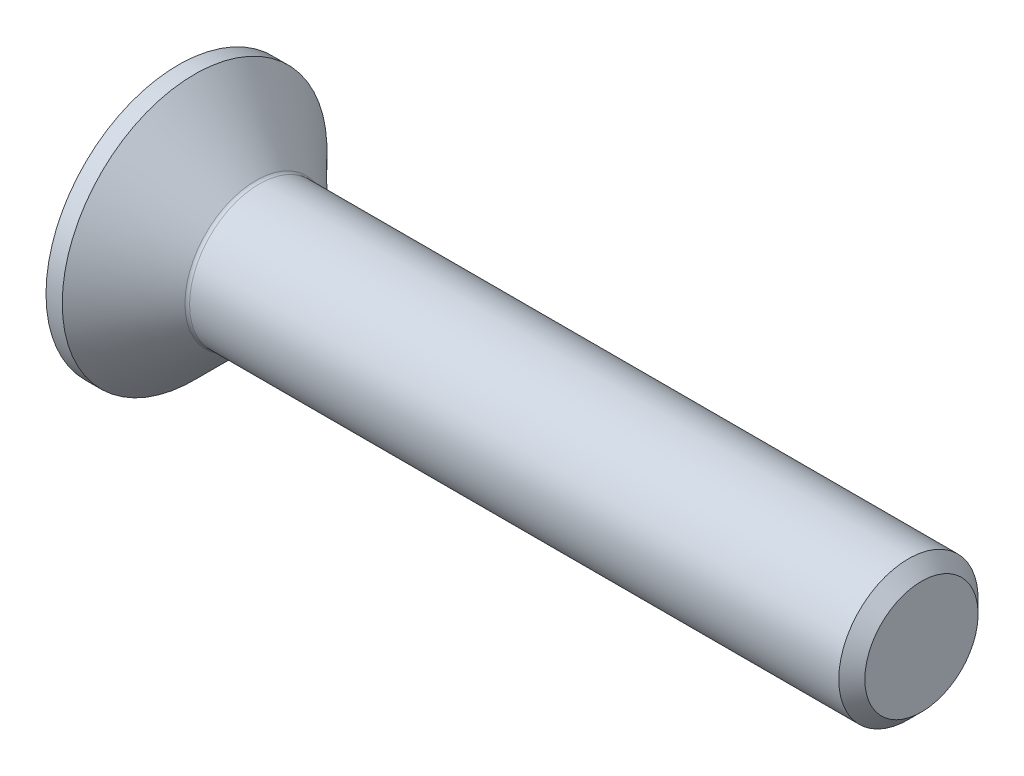
from build123d import *

# Parameters (mm, degrees)
FILLET1_R   = 0.1
HEX_2_DEPTH = 1.2


with BuildPart() as part:
    # BodySke → BaseBody (revolve)
    with BuildSketch(Plane.XY, mode=Mode.PRIVATE) as basebody_sk:
        Polygon((0, 0), (0, 2.85), (0.35, 2.85), (1.7, 1.5), (15.7195, 1.5), (16, 1.2195), (16, 0), align=None)
    revolve(basebody_sk.sketch.rotate(Axis((0, 0, 0), (1, 0, 0)), 90), axis=Axis((0, 0, 0), (1, 0, 0)))

    # Fillet1
    fillet1_edges = [part.edges().sort_by_distance(p)[0] for p in [
        (1.7, 0, -1.5),
    ]]
    fillet(fillet1_edges, radius=FILLET1_R)

    # Sketch2 → PreBroach (revolve, cut)
    with BuildSketch(Plane.XY, mode=Mode.PRIVATE) as prebroach_sk:
        Polygon((0, 1.01), (1.2, 1.01), (1.783123772, 0), (0, 0), align=None)
    revolve(prebroach_sk.sketch.rotate(Axis((0, 0, 0), (1, 0, 0)), 90), axis=Axis((0, 0, 0), (1, 0, 0)), mode=Mode.SUBTRACT)

    # Sketch3 → Hex 2 (cut)
    with BuildSketch(Plane.ZY):
        Polygon((-1.01, -0.583123772), (-1.01, 0.583123772), (0, 1.166247544), (1.01, 0.583123772), (1.01, -0.583123772), (0, -1.166247544), align=None)
    extrude(amount=-HEX_2_DEPTH, mode=Mode.SUBTRACT)


solid = part.part
